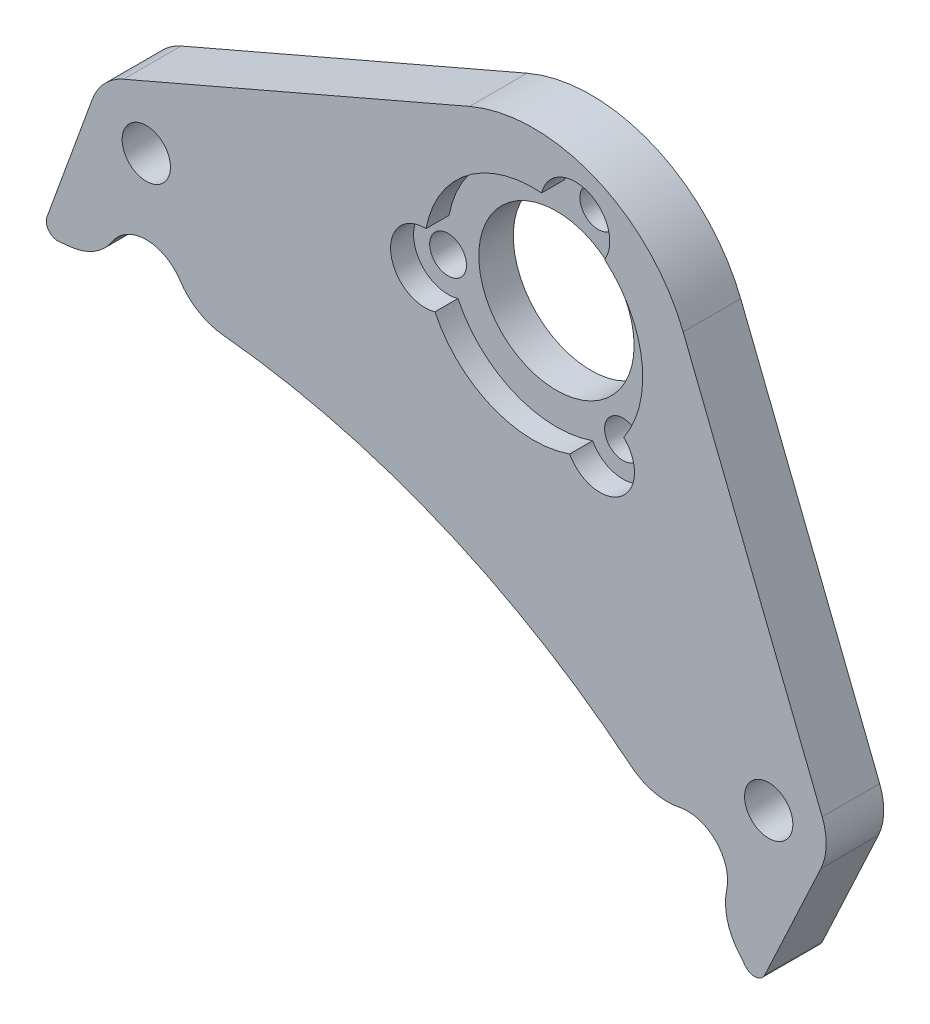
from build123d import *

# Parameters (mm, degrees)
SKETCH_3_R          = 1.6
SKETCH_3_R_2        = 6.75
SKETCH_3_R_3        = 2.1
EXTRUDE_1_DEPTH     = 5
FILLET_1_R          = 5
FILLET_2_R          = 1
SKETCH_4_R          = 3
CUT_EXTRUDE_1_DEPTH = 2
SKETCH_5_R          = 9.5
CUT_EXTRUDE_2_DEPTH = 2


with BuildPart() as part:
    # 草图3 → 凸台-拉伸1 (new body)
    with BuildSketch(Plane.XY):
        with BuildLine():
            Line((-1.982924342, 81.089990311), (28.095252633, 94.084080766))
            ThreePointArc((28.095252633, 94.084080766), (39.005008844, 94.166421351), (46.661147856, 86.393835167))
            Line((46.661147856, 86.393835167), (58.741421284, 55.937142786))
            ThreePointArc((58.741421284, 55.937142786), (59.091513319, 53.946870364), (58.625207696, 51.980577452))
            Line((58.625207696, 51.980577452), (53.071542706, 40.070704446))
            ThreePointArc((53.071542706, 40.070704446), (51.29898623, 42.316238157), (49.431489328, 44.483456058))
            ThreePointArc((49.431489328, 44.483456058), (49.497474683, 49.497474683), (44.483456058, 49.431489328))
            ThreePointArc((44.483456058, 49.431489328), (25.448448252, 61.437988912), (3.498787879, 66.407894737))
            ThreePointArc((3.498787879, 66.407894737), (0, 70), (-3.498787879, 66.407894737))
            ThreePointArc((-3.498787879, 66.407894737), (-6.351762076, 66.195959986), (-9.192980894, 65.861514576))
            Line((-9.192980894, 65.861514576), (-4.698463104, 78.210100717))
            ThreePointArc((-4.698463104, 78.210100717), (-3.637811921, 79.930207637), (-1.982924342, 81.089990311))
        make_face()
        with Locations((37.282933398, 90.008963455)):
            Circle(SKETCH_3_R, mode=Mode.SUBTRACT)
        with Locations((39.430674366, 73.695251163)):
            Circle(SKETCH_3_R, mode=Mode.SUBTRACT)
        with Locations((24.228714608, 79.99210907)):
            Circle(SKETCH_3_R, mode=Mode.SUBTRACT)
        with Locations((33.647440791, 81.232107896)):
            Circle(SKETCH_3_R_2, mode=Mode.SUBTRACT)
        with Locations((0, 76.5)):
            Circle(SKETCH_3_R_3, mode=Mode.SUBTRACT)
        with Locations((54.093668761, 54.093668761)):
            Circle(SKETCH_3_R_3, mode=Mode.SUBTRACT)
    extrude(amount=EXTRUDE_1_DEPTH)

    # 圆角1
    fillet_1_edges = [part.edges().sort_by_distance(p)[0] for p in [
        (-3.498787879, 66.407894737, 2.5),
        (3.498787879, 66.407894737, 2.5),
        (44.483456058, 49.431489328, 2.5),
        (49.431489328, 44.483456058, 2.5),
    ]]
    fillet(fillet_1_edges, radius=FILLET_1_R)

    # 圆角2
    fillet_2_edges = [part.edges().sort_by_distance(p)[0] for p in [
        (-9.192980894, 65.861514576, 2.5),
        (53.071542706, 40.070704446, 2.5),
    ]]
    fillet(fillet_2_edges, radius=FILLET_2_R)

    # 草图4 → 切除-拉伸1 (cut)
    with BuildSketch(Plane.XY.offset(5)):
        with Locations((37.282933398, 90.008963455)):
            Circle(SKETCH_4_R)
        with Locations((39.430674366, 73.695251163)):
            Circle(SKETCH_4_R)
        with Locations((24.228714608, 79.99210907)):
            Circle(SKETCH_4_R)
    extrude(amount=-CUT_EXTRUDE_1_DEPTH, mode=Mode.SUBTRACT)

    # 草图5 → 切除-拉伸2 (cut)
    with BuildSketch(Plane.XY.offset(5)):
        with Locations((33.647440791, 81.232107896)):
            Circle(SKETCH_5_R)
    extrude(amount=-CUT_EXTRUDE_2_DEPTH, mode=Mode.SUBTRACT)


solid = part.part
